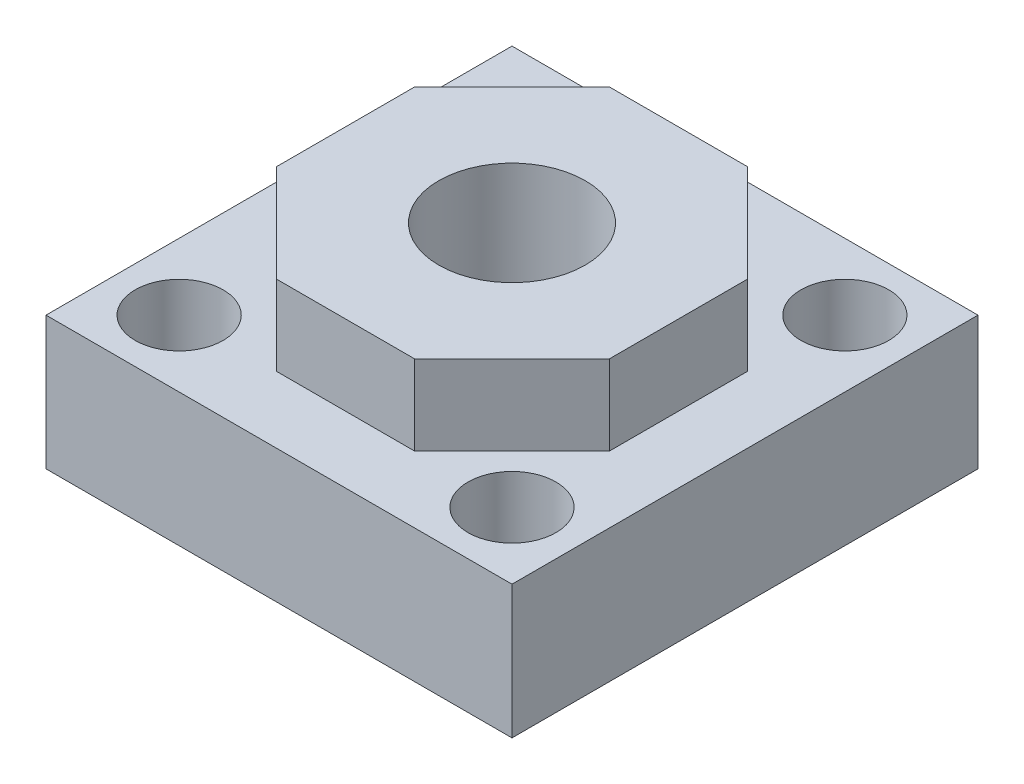
from build123d import *

# Parameters (mm, degrees)
SKETCH1_W             = 35
SKETCH1_H             = 35
BOSS_EXTRUDE1_DEPTH   = 10
BOSS_EXTRUDE2_DEPTH   = 6
M10_CLEARANCE_HOLE1_D = 11
M6_CLEARANCE_HOLE1_D  = 6.6
MIRROR2_COPY_1_D      = 6.6
MIRROR2_COPY_2_D      = 6.6


with BuildPart() as part:
    # Sketch1 → Boss-Extrude1 (new body)
    with BuildSketch(Plane(origin=(0, 0, 0), x_dir=(1, 0, 0), z_dir=(0, 1, 0))):
        Rectangle(SKETCH1_W, SKETCH1_H)
    extrude(amount=-BOSS_EXTRUDE1_DEPTH)

    # Sketch1<3> → Boss-Extrude2 (add)
    with BuildSketch(Plane(origin=(0, 0, 0), x_dir=(1, 0, 0), z_dir=(0, 1, 0))):
        Polygon((-5.17766953, -12.5), (5.17766953, -12.5), (12.5, -5.17766953), (12.5, 5.17766953), (5.17766953, 12.5), (-5.17766953, 12.5), (-12.5, 5.17766953), (-12.5, -5.17766953), align=None)
    extrude(amount=BOSS_EXTRUDE2_DEPTH)

    # M10 Clearance Hole1 (through all)
    with Locations(Plane(origin=(0, 6, 0), x_dir=(1, 0, 0), z_dir=(0, 1, 0))):
        with Locations((0, 0)):
            Hole(M10_CLEARANCE_HOLE1_D / 2)

    # M6 Clearance Hole1 (through all)
    with Locations(Plane(origin=(0, 0, 0), x_dir=(1, 0, 0), z_dir=(0, 1, 0))):
        with Locations((-12.5, 12.5)):
            m6_clearance_hole1 = Hole(M6_CLEARANCE_HOLE1_D / 2)

    # Mirror1: M6 Clearance Hole1 across plane
    add(m6_clearance_hole1.mirror(Plane(origin=(0, 0, 0), x_dir=(0, 0, 1), z_dir=(1, 0, 0))), mode=Mode.SUBTRACT)

    # Mirror2 copy 1 (through all)
    with Locations(Plane(origin=(0, 0, 0), x_dir=(-1, 0, 0), z_dir=(0, 1, 0))):
        with Locations((-12.5, 12.5)):
            Hole(MIRROR2_COPY_1_D / 2)

    # Mirror2 copy 2 (through all)
    with Locations(Plane(origin=(0, 0, 0), x_dir=(1, 0, 0), z_dir=(0, 1, 0))):
        with Locations((-12.5, -12.5)):
            Hole(MIRROR2_COPY_2_D / 2)


solid = part.part
